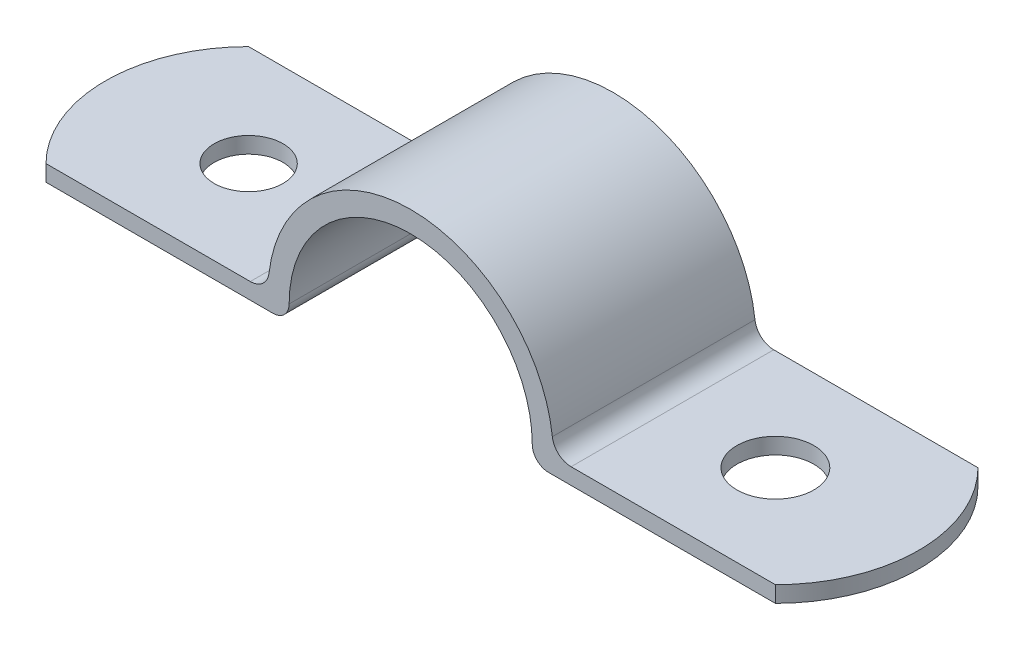
from build123d import *

# Parameters (mm, degrees)
SKETCH_1_R          = 1.7
EXTRUDE_1_DEPTH     = 0.8
SKETCH_1_R_2        = 1.9
EXTRUDE_1_2_DEPTH   = 0.8
EXTRUDE_5_DEPTH     = 10
CUT_EXTRUDE_3_DEPTH = 10
CUT_EXTRUDE_4_DEPTH = 10


with BuildPart() as part:
    # 草图1 → 凸台-拉伸1 (new body)
    with BuildSketch(Plane(origin=(0, 0, 0), x_dir=(1, 0, 0), z_dir=(0, 1, 0))):
        with BuildLine():
            Line((0, -10), (12, -10))
            Line((12, -10), (12, 0))
            Line((12, 0), (0, 0))
            ThreePointArc((0, 0), (-2.071067812, -5), (0, -10))
        make_face()
        with Locations(Location((5, -5, 0), (0, 0, 270))):
            Circle(SKETCH_1_R, mode=Mode.SUBTRACT)
    extrude(amount=EXTRUDE_1_DEPTH)



with BuildPart() as body_2:
    # 草图1 → Extrude 1 2 (new body)
    with BuildSketch(Plane(origin=(0, 0, 0), x_dir=(1, 0, 0), z_dir=(0, 1, 0))):
        with BuildLine():
            Line((24, -10), (24, 0))
            Line((24, 0), (36, 0))
            ThreePointArc((36, 0), (38.071067812, -5), (36, -10))
            Line((36, -10), (24, -10))
        make_face()
        with Locations(Location((31, -5, 0), (0, 0, 270))):
            Circle(SKETCH_1_R_2, mode=Mode.SUBTRACT)
    extrude(amount=EXTRUDE_1_2_DEPTH)


with BuildPart() as part_1:
    add(part.part)

    add(body_2.part)  # 凸台-拉伸5 merges body 2
    # 草图2 → 凸台-拉伸5 (add)
    with BuildSketch(Plane.XY.offset(10)):
        with BuildLine():
            ThreePointArc((11.007949102, 1.622594223), (10.70184983, 1.035393399), (10.082905956, 0.8))
            Line((10.082905956, 0.8), (12, 0.8))
            ThreePointArc((12, 0.8), (18, 6.8), (24, 0.8))
            Line((24, 0.8), (25.917094044, 0.8))
            ThreePointArc((25.917094044, 0.8), (25.29815017, 1.035393399), (24.992050898, 1.622594223))
            ThreePointArc((24.992050898, 1.622594223), (18, 7.84027251), (11.007949102, 1.622594223))
        make_face()
    extrude(amount=-EXTRUDE_5_DEPTH)

    # 草图3 → 切除-拉伸3 (cut)
    with BuildSketch(Plane.XY.offset(10)):
        with BuildLine():
            Line((11.2, 0), (12, 0))
            Line((12, 0), (12, 0.8))
            ThreePointArc((12, 0.8), (11.765685425, 0.234314575), (11.2, 0))
        make_face()
    extrude(amount=-CUT_EXTRUDE_3_DEPTH, mode=Mode.SUBTRACT)

    # 草图4 → 切除-拉伸4 (cut)
    with BuildSketch(Plane.XY.offset(10)):
        with BuildLine():
            Line((24, 0.8), (24, 0))
            Line((24, 0), (24.8, 0))
            ThreePointArc((24.8, 0), (24.234314575, 0.234314575), (24, 0.8))
        make_face()
    extrude(amount=-CUT_EXTRUDE_4_DEPTH, mode=Mode.SUBTRACT)


solid = part_1.part
